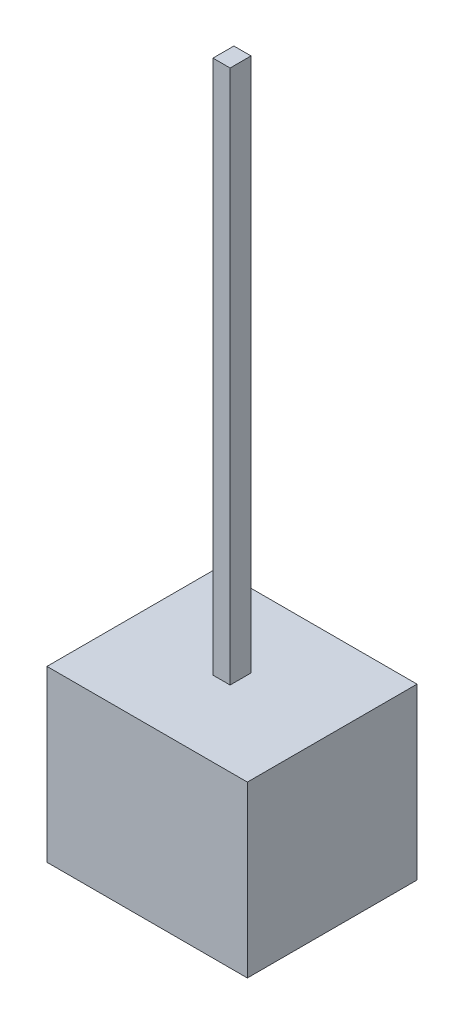
from build123d import *

# Parameters (mm, degrees)
SKETCH_1_W      = 2.54
SKETCH_1_H      = 2.54
EXTRUDE_1_DEPTH = 3
SKETCH_2_W      = 0.256815191
SKETCH_2_H      = 0.313314533
EXTRUDE_2_DEPTH = 8


with BuildPart() as part:
    # 草图1 → 凸台-拉伸1 (new body)
    with BuildSketch(Plane(origin=(0, 0, 0), x_dir=(0, 0, -1), z_dir=(1, 0, 0))):
        with Locations((1.27, -1.27)):
            Rectangle(SKETCH_1_W, SKETCH_1_H)
    extrude(amount=EXTRUDE_1_DEPTH)

    # 草图2 → 凸台-拉伸2 (add)
    with BuildSketch(Plane(origin=(0, 0, 0), x_dir=(1, 0, 0), z_dir=(0, 1, 0))):
        with Locations((1.484591089, 1.285408912)):
            Rectangle(SKETCH_2_W, SKETCH_2_H)
    extrude(amount=EXTRUDE_2_DEPTH)


solid = part.part
